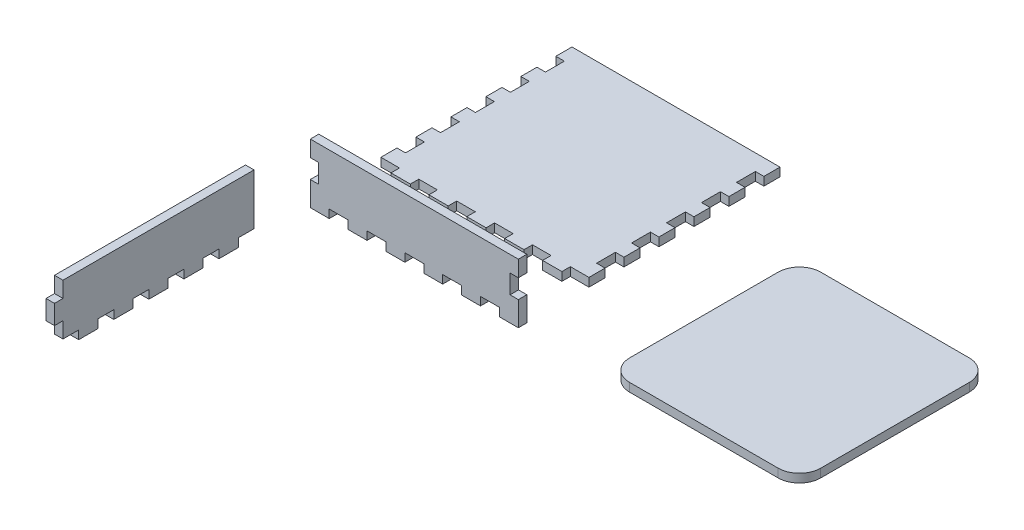
from build123d import *

# Parameters (mm, degrees)
BOSS_EXTRUDE1_DEPTH = 4
BOSS_EXTRUDE2_DEPTH = 4
BOSS_EXTRUDE3_DEPTH = 4
BOSS_EXTRUDE4_DEPTH = 4


with BuildPart() as part:
    # Sketch1 → Boss-Extrude1 (new body)
    with BuildSketch(Plane(origin=(0, 0, 0), x_dir=(1, 0, 0), z_dir=(0, 1, 0))):
        with BuildLine():
            Line((10, 0), (80, 0))
            ThreePointArc((80, 0), (87.071067812, 2.928932188), (90, 10))
            Line((90, 10), (90, 80))
            ThreePointArc((90, 80), (87.071067812, 87.071067812), (80, 90))
            Line((80, 90), (10, 90))
            ThreePointArc((10, 90), (2.928932188, 87.071067812), (0, 80))
            Line((0, 80), (0, 10))
            ThreePointArc((0, 10), (2.928932188, 2.928932188), (10, 0))
        make_face()
    extrude(amount=BOSS_EXTRUDE1_DEPTH)


with BuildPart() as body_2:
    # Sketch2 → Boss-Extrude2 (new body)
    with BuildSketch(Plane.XY):
        Polygon((-140.425884488, 0.066456233), (-131.509217822, 0.066456233), (-131.509217822, 3.966456233), (-122.609217822, 3.966456233), (-122.609217822, 0.066456233), (-113.692551155, 0.066456233), (-113.692551155, 3.966456233), (-104.792551155, 3.966456233), (-104.792551155, 0.066456233), (-95.875884488, 0.066456233), (-95.875884488, 3.966456233), (-86.975884488, 3.966456233), (-86.975884488, 0.066456233), (-78.059217822, 0.066456233), (-78.059217822, 3.966456233), (-69.159217822, 3.966456233), (-69.159217822, 0.066456233), (-60.242551155, 0.066456233), (-60.242551155, 3.966456233), (-51.342551155, 3.966456233), (-51.342551155, 0.066456233), (-42.425884488, 0.066456233), (-42.425884488, 11.566456233), (-46.325884488, 11.566456233), (-46.325884488, 20.466456233), (-42.425884488, 20.466456233), (-42.425884488, 28.066456233), (-140.425884488, 28.066456233), (-140.425884488, 20.466456233), (-136.525884488, 20.466456233), (-136.525884488, 11.566456233), (-140.425884488, 11.566456233), align=None)
    extrude(amount=-BOSS_EXTRUDE2_DEPTH)


with BuildPart() as body_3:
    # Sketch4 → Boss-Extrude3 (new body)
    with BuildSketch(Plane(origin=(0, 0, 0), x_dir=(1, 0, 0), z_dir=(0, 1, 0))):
        Polygon((-51.175884488, 29.265358113), (-60.275884488, 29.265358113), (-60.275884488, 33.265358113), (-69.025884488, 33.265358113), (-69.025884488, 29.265358113), (-78.125884488, 29.265358113), (-78.125884488, 33.265358113), (-86.875884488, 33.265358113), (-86.875884488, 29.265358113), (-95.975884488, 29.265358113), (-95.975884488, 33.265358113), (-104.725884488, 33.265358113), (-104.725884488, 29.265358113), (-113.825884488, 29.265358113), (-113.825884488, 33.265358113), (-122.575884488, 33.265358113), (-122.575884488, 29.265358113), (-131.675884488, 29.265358113), (-131.675884488, 33.265358113), (-140.425884488, 33.265358113), (-140.425884488, 40.848691447), (-136.425884488, 40.848691447), (-136.425884488, 49.748691447), (-140.425884488, 49.748691447), (-140.425884488, 57.33202478), (-136.425884488, 57.33202478), (-136.425884488, 66.23202478), (-140.425884488, 66.23202478), (-140.425884488, 73.815358113), (-136.425884488, 73.815358113), (-136.425884488, 82.715358113), (-140.425884488, 82.715358113), (-140.425884488, 90.298691447), (-136.425884488, 90.298691447), (-136.425884488, 99.198691447), (-140.425884488, 99.198691447), (-140.425884488, 106.78202478), (-136.425884488, 106.78202478), (-136.425884488, 115.68202478), (-140.425884488, 115.68202478), (-140.425884488, 123.265358113), (-42.425884488, 123.265358113), (-42.425884488, 115.68202478), (-46.425884488, 115.68202478), (-46.425884488, 106.78202478), (-42.425884488, 106.78202478), (-42.425884488, 99.198691447), (-46.425884488, 99.198691447), (-46.425884488, 90.298691447), (-42.425884488, 90.298691447), (-42.425884488, 82.715358113), (-46.425884488, 82.715358113), (-46.425884488, 73.815358113), (-42.425884488, 73.815358113), (-42.425884488, 66.23202478), (-46.425884488, 66.23202478), (-46.425884488, 57.33202478), (-42.425884488, 57.33202478), (-42.425884488, 49.748691447), (-46.425884488, 49.748691447), (-46.425884488, 40.848691447), (-42.425884488, 40.848691447), (-42.425884488, 33.265358113), (-51.175884488, 33.265358113), align=None)
    extrude(amount=BOSS_EXTRUDE3_DEPTH)


with BuildPart() as body_4:
    # Sketch5 → Boss-Extrude4 (new body)
    with BuildSketch(Plane.ZY.offset(140.425884488)):
        Polygon((120.507785088, 21.291262613), (116.507785088, 21.291262613), (116.507785088, 28.741262613), (26.507785088, 28.741262613), (26.507785088, 4.741262613), (33.924451754, 4.741262613), (33.924451754, 0.741262613), (43.024451754, 0.741262613), (43.024451754, 4.741262613), (50.441118421, 4.741262613), (50.441118421, 0.741262613), (59.541118421, 0.741262613), (59.541118421, 4.741262613), (66.957785088, 4.741262613), (66.957785088, 0.741262613), (76.057785088, 0.741262613), (76.057785088, 4.741262613), (83.474451754, 4.741262613), (83.474451754, 0.741262613), (92.574451754, 0.741262613), (92.574451754, 4.741262613), (99.991118421, 4.741262613), (99.991118421, 0.741262613), (109.091118421, 0.741262613), (109.091118421, 4.741262613), (116.507785088, 4.741262613), (116.507785088, 12.191262613), (120.507785088, 12.191262613), align=None)
    extrude(amount=BOSS_EXTRUDE4_DEPTH)


solid = Compound([part.part, body_2.part, body_3.part, body_4.part])
